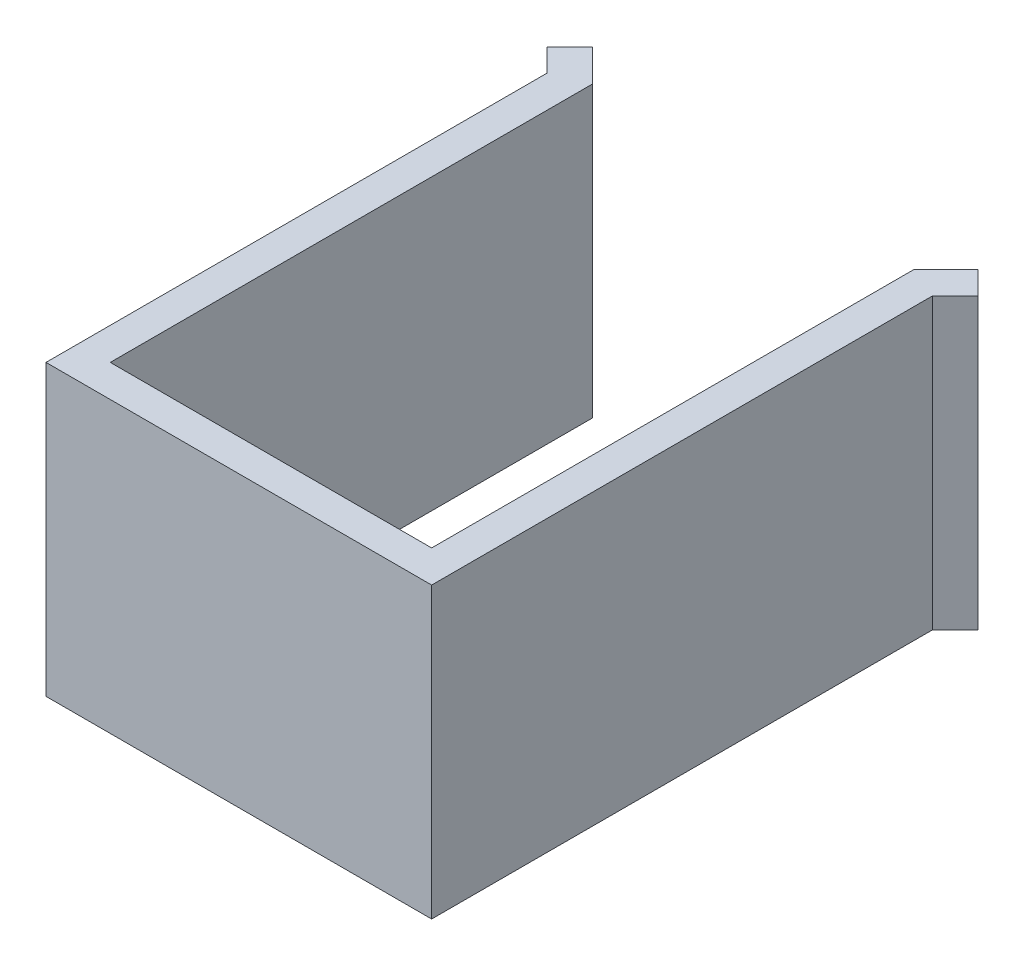
from build123d import *

# Parameters (mm, degrees)
VYSUNOUT_TENKOST_NN_1_DEPTH = 90


with BuildPart() as part:
    # Skica78 → Vysunout tenkostěnný1 (new body)
    with BuildSketch(Plane(origin=(0, 0, 0), x_dir=(1, 0, 0), z_dir=(0, 1, 0))):
        Polygon((60, 160), (50, 150), (50, 0), (-50, 0), (-50, 150), (-60, 160), (-67.071067812, 152.928932188), (-60, 145.857864376), (-60, -10), (60, -10), (60, 145.857864376), (67.071067812, 152.928932188), align=None)
    extrude(amount=VYSUNOUT_TENKOST_NN_1_DEPTH)


solid = part.part
